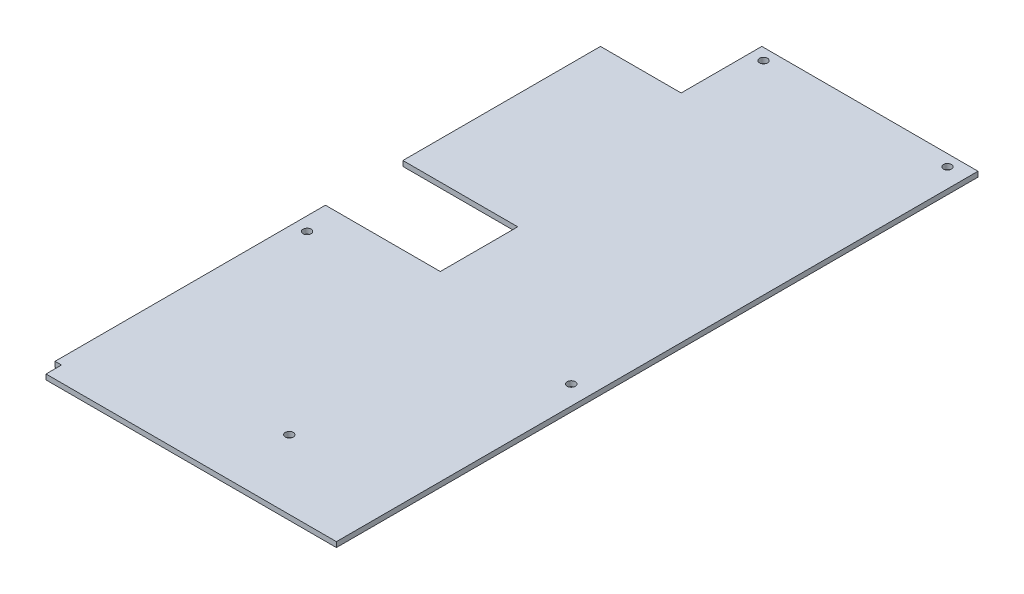
from build123d import *

# Parameters (mm, degrees)
SKETCH2_W          = 93
SKETCH2_H          = 198.84
EXTRUDE1_DEPTH     = 1.6
SKETCH3_W          = 2
SKETCH3_H          = 4.8
CUT_EXTRUDE1_DEPTH = 220.519715743
SKETCH4_W          = 35.6
SKETCH4_H          = 24
CUT_EXTRUDE2_DEPTH = 220.519715743
SKETCH6_W          = 25
SKETCH6_H          = 25
CUT_EXTRUDE3_DEPTH = 220.519715743
SKETCH7_R          = 1.25
CUT_EXTRUDE4_DEPTH = 220.519715743
SKETCH8_R          = 1.25
CUT_EXTRUDE5_DEPTH = 220.519715743
SKETCH10_W         = 1
SKETCH10_H         = 1.6
CUT_EXTRUDE6_DEPTH = 220.519715743


with BuildPart() as part:
    # Sketch2 → Extrude1 (new body)
    with BuildSketch(Plane(origin=(0, 0, 0), x_dir=(1, 0, 0), z_dir=(0, 1, 0))):
        with Locations((46.5, 99.42)):
            Rectangle(SKETCH2_W, SKETCH2_H)
    extrude(amount=EXTRUDE1_DEPTH)

    # Sketch3 → Cut-Extrude1 (cut, through all)
    with BuildSketch(Plane(origin=(0, 1.6, 0), x_dir=(-1, 0, 0), z_dir=(0, 1, 0))):
        with Locations((-1, -2.4)):
            Rectangle(SKETCH3_W, SKETCH3_H)
    extrude(amount=-CUT_EXTRUDE1_DEPTH, mode=Mode.SUBTRACT)

    # Sketch4 → Cut-Extrude2 (cut, through all)
    with BuildSketch(Plane(origin=(0, 1.6, 0), x_dir=(-1, 0, 0), z_dir=(0, 1, 0))):
        with Locations((-17.8, -100.6)):
            Rectangle(SKETCH4_W, SKETCH4_H)
    extrude(amount=-CUT_EXTRUDE2_DEPTH, mode=Mode.SUBTRACT)

    # Sketch6 → Cut-Extrude3 (cut, through all)
    with BuildSketch(Plane(origin=(0, 1.6, 0), x_dir=(-1, 0, 0), z_dir=(0, 1, 0))):
        with Locations((-12.5, -186.34)):
            Rectangle(SKETCH6_W, SKETCH6_H)
    extrude(amount=-CUT_EXTRUDE3_DEPTH, mode=Mode.SUBTRACT)

    # Sketch7 → Cut-Extrude4 (cut, through all)
    with BuildSketch(Plane(origin=(0, 1.6, 0), x_dir=(-1, 0, 0), z_dir=(0, 1, 0))):
        with Locations(Location((-29.077, -195.3, 0), (0, 0, 90))):
            Circle(SKETCH7_R)
        with Locations(Location((-86.077, -195.3, 0), (0, 0, 90))):
            Circle(SKETCH7_R)
        with Locations(Location((-4.2, -78.7, 0), (0, 0, 90))):
            Circle(SKETCH7_R)
        with Locations(Location((-86.077, -78.7, 0), (0, 0, 90))):
            Circle(SKETCH7_R)
    extrude(amount=-CUT_EXTRUDE4_DEPTH, mode=Mode.SUBTRACT)

    # Sketch8 → Cut-Extrude5 (cut, through all)
    with BuildSketch(Plane(origin=(0, 1.6, 0), x_dir=(-1, 0, 0), z_dir=(0, 1, 0))):
        with Locations(Location((-56, -21.4, 0), (0, 0, 90))):
            Circle(SKETCH8_R)
    extrude(amount=-CUT_EXTRUDE5_DEPTH, mode=Mode.SUBTRACT)

    # Sketch10 → Cut-Extrude6 (cut, through all)
    with BuildSketch(Plane(origin=(0, 0, -198.84), x_dir=(-1, 0, 0), z_dir=(0, 0, -1))):
        with Locations((-92.5, 0.8)):
            Rectangle(SKETCH10_W, SKETCH10_H)
    extrude(amount=-CUT_EXTRUDE6_DEPTH, mode=Mode.SUBTRACT)


solid = part.part
